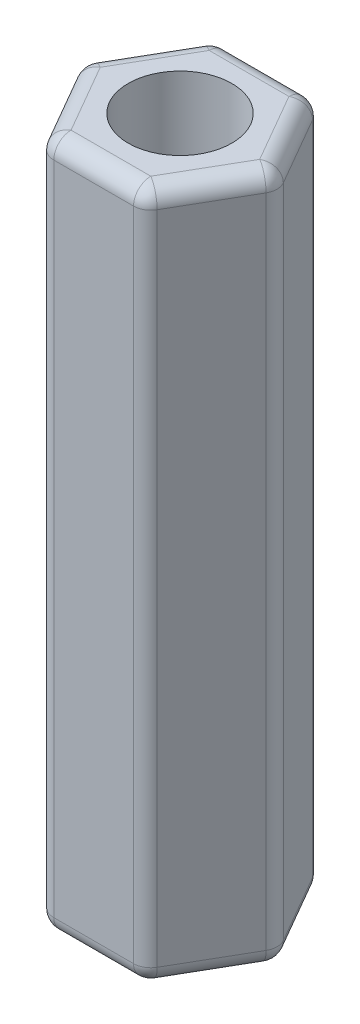
from build123d import *

# Parameters (mm, degrees)
SKETCH1_R           = 1.5
BOSS_EXTRUDE1_DEPTH = 20
FILLET1_R           = 0.5


with BuildPart() as part:
    # Sketch1 → Boss-Extrude1 (new body)
    with BuildSketch(Plane(origin=(0, 0, 0), x_dir=(1, 0, 0), z_dir=(0, 1, 0))):
        Polygon((-1.443375673, 2.5), (-2.886751346, 0), (-1.443375673, -2.5), (1.443375673, -2.5), (2.886751346, 0), (1.443375673, 2.5), align=None)
        with Locations(Location((0, 0, 0), (0, 0, 270))):
            Circle(SKETCH1_R, mode=Mode.SUBTRACT)
    extrude(amount=BOSS_EXTRUDE1_DEPTH)

    # Fillet1
    fillet1_edges = [part.edges().sort_by_distance(p)[0] for p in [
        (-2.165063509, 20, 1.25),
        (1.443375673, 10, -2.5),
        (2.886751346, 10, 0),
        (1.443375673, 10, 2.5),
        (-1.443375673, 10, 2.5),
        (-2.886751346, 10, 0),
        (-1.443375673, 10, -2.5),
        (0, 20, 2.5),
        (2.165063509, 20, 1.25),
        (2.165063509, 20, -1.25),
        (0, 20, -2.5),
        (2.165063509, 0, -1.25),
        (2.165063509, 0, 1.25),
        (0, 0, 2.5),
        (-2.165063509, 20, -1.25),
        (-2.165063509, 0, 1.25),
        (-2.165063509, 0, -1.25),
        (0, 0, -2.5),
    ]]
    fillet(fillet1_edges, radius=FILLET1_R)


solid = part.part
